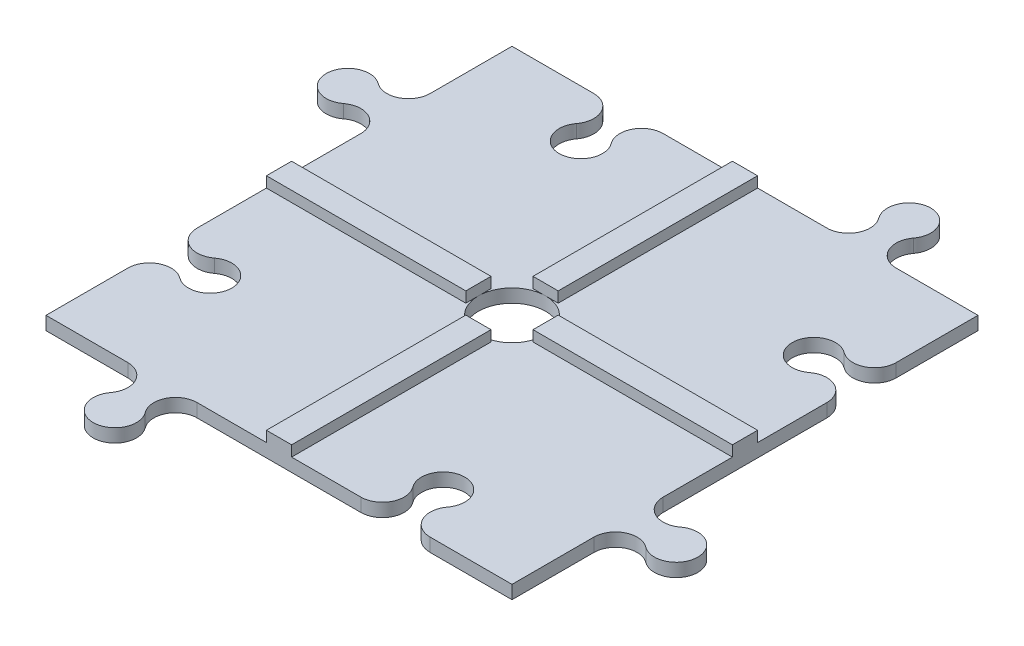
from build123d import *

# Parameters (mm, degrees)
SKETCH1_W           = 111
SKETCH1_H           = 111
BOSS_EXTRUDE1_DEPTH = 3.175
BOSS_EXTRUDE2_DEPTH = 3.175
CUT_EXTRUDE2_DEPTH  = 91.971263182
CIRPATTERN1_COUNT   = 4
SKETCH4_R           = 8.001
CUT_EXTRUDE3_DEPTH  = 3.175
SKETCH5_W           = 47.499
SKETCH5_H           = 3
BOSS_EXTRUDE3_DEPTH = 2.54
CIRPATTERN2_COUNT   = 4


with BuildPart() as part:
    # Sketch1 → Boss-Extrude1 (new body)
    with BuildSketch(Plane(origin=(0, 0, 0), x_dir=(1, 0, 0), z_dir=(0, 1, 0))):
        Rectangle(SKETCH1_W, SKETCH1_H)
    extrude(amount=BOSS_EXTRUDE1_DEPTH)

    # Sketch2 → Boss-Extrude2 (add)
    with BuildSketch(Plane(origin=(0, 0, 0), x_dir=(1, 0, 0), z_dir=(0, 1, 0))):
        with BuildLine():
            Line((-55.5, 36.005), (-55.5, 19.495))
            ThreePointArc((-55.5, 19.495), (-58.352032356, 24.109685289), (-63.755, 23.6225))
            ThreePointArc((-63.755, 23.6225), (-69.157967644, 23.135314711), (-72.01, 27.75))
            ThreePointArc((-72.01, 27.75), (-69.157967644, 32.364685289), (-63.755, 31.8775))
            ThreePointArc((-63.755, 31.8775), (-58.352032356, 31.390314711), (-55.5, 36.005))
        make_face()
    boss_extrude2 = extrude(amount=BOSS_EXTRUDE2_DEPTH)

    # Sketch2<3> → Cut-Extrude2 (cut, through all)
    with BuildSketch(Plane(origin=(0, 0, 0), x_dir=(1, 0, 0), z_dir=(0, 1, 0))):
        with BuildLine():
            Line((-55.5, -36.005), (-55.5, -19.495))
            ThreePointArc((-55.5, -19.495), (-52.647967644, -24.109685289), (-47.245, -23.6225))
            ThreePointArc((-47.245, -23.6225), (-41.842032356, -23.135314711), (-38.99, -27.75))
            ThreePointArc((-38.99, -27.75), (-41.842032356, -32.364685289), (-47.245, -31.8775))
            ThreePointArc((-47.245, -31.8775), (-52.647967644, -31.390314711), (-55.5, -36.005))
        make_face()
    cut_extrude2 = extrude(amount=CUT_EXTRUDE2_DEPTH, mode=Mode.SUBTRACT)

    # CirPattern1: Boss-Extrude2, Cut-Extrude2 ×4 about axis
    cirpattern1_axis = Axis((0, 0, 0), (0, 1, 0))
    add([boss_extrude2.rotate(cirpattern1_axis, i * 360 / CIRPATTERN1_COUNT) for i in range(1, CIRPATTERN1_COUNT)])
    add([cut_extrude2.rotate(cirpattern1_axis, i * 360 / CIRPATTERN1_COUNT) for i in range(1, CIRPATTERN1_COUNT)], mode=Mode.SUBTRACT)

    # Sketch4 → Cut-Extrude3 (cut)
    with BuildSketch(Plane(origin=(0, 3.175, 0), x_dir=(1, 0, 0), z_dir=(0, 1, 0))):
        with Locations(Location((0, 0, 0), (0, 0, 270))):
            Circle(SKETCH4_R)
    extrude(amount=-CUT_EXTRUDE3_DEPTH, mode=Mode.SUBTRACT)

    # Sketch5 → Boss-Extrude3 (add)
    with BuildSketch(Plane(origin=(0, 3.175, 0), x_dir=(1, 0, 0), z_dir=(0, 1, 0))):
        with Locations((-31.7505, -1.5)):
            Rectangle(SKETCH5_W, SKETCH5_H)
        with Locations((-31.7505, 1.5)):
            Rectangle(SKETCH5_W, SKETCH5_H)
    boss_extrude3 = extrude(amount=BOSS_EXTRUDE3_DEPTH)

    # CirPattern2: Boss-Extrude3 ×4 about axis
    cirpattern2_axis = Axis((0, 0, 0), (0, 1, 0))
    for i in range(1, CIRPATTERN2_COUNT):
        add(boss_extrude3.rotate(cirpattern2_axis, i * 360 / CIRPATTERN2_COUNT))


solid = part.part
